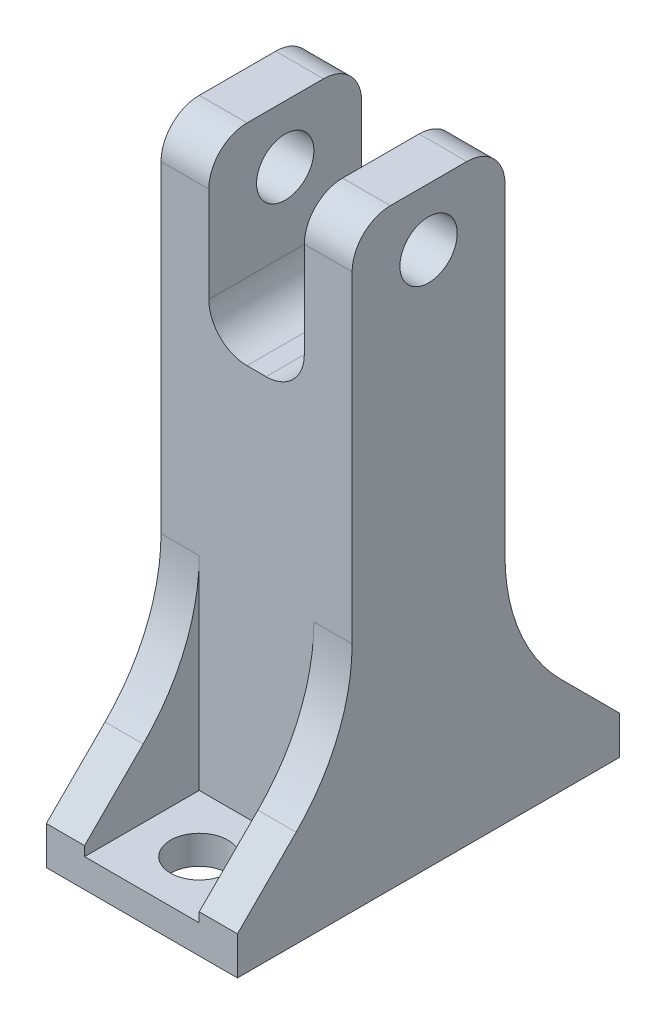
from build123d import *

# Parameters (mm, degrees)
BOSS_EXTRUDE1_DEPTH = 4
SKETCH2_R           = 1.5
CUT_EXTRUDE1_DEPTH  = 19.874586088
BOSS_EXTRUDE2_DEPTH = 5
SKETCH4_W           = 6
SKETCH4_H           = 6
CUT_EXTRUDE2_DEPTH  = 14
SKETCH6_R           = 1.5
CUT_EXTRUDE3_DEPTH  = 20.111514854
FILLET1_R           = 10
FILLET2_R           = 2
FILLET3_R           = 2


with BuildPart() as part:
    # Sketch1 → Boss-Extrude1 (new, symmetric)
    with BuildSketch(Plane.XY):
        Polygon((2.5, 15.5), (5, 15.5), (5, -15.5), (-5, -15.5), (-5, 15.5), (-2.5, 15.5), (-2.5, 6.5), (2.5, 6.5), align=None)
    extrude(amount=BOSS_EXTRUDE1_DEPTH, both=True)

    # Sketch2 → Cut-Extrude1 (cut, through all)
    with BuildSketch(Plane(origin=(5, 0, 0), x_dir=(0, 0, -1), z_dir=(1, 0, 0))):
        with Locations((0, 12.5)):
            Circle(SKETCH2_R)
    extrude(amount=-CUT_EXTRUDE1_DEPTH, mode=Mode.SUBTRACT)

    # Sketch3 → Boss-Extrude2 (add, symmetric)
    with BuildSketch(Plane(origin=(0, 0, 0), x_dir=(0, 0, -1), z_dir=(1, 0, 0))):
        Polygon((-4, -15.5), (-10, -15.5), (-10, -13.5), (-4, -7.5), align=None)
        Polygon((4, -7.5), (4, -15.5), (10, -15.5), (10, -13.5), align=None)
    extrude(amount=BOSS_EXTRUDE2_DEPTH, both=True)

    # Sketch4 → Cut-Extrude2 (cut)
    with BuildSketch(Plane(origin=(0, 0, 0), x_dir=(1, 0, 0), z_dir=(0, 1, 0))):
        with Locations((0, 7)):
            Rectangle(SKETCH4_W, SKETCH4_H)
        with Locations((0, -7)):
            Rectangle(SKETCH4_W, SKETCH4_H)
    extrude(amount=-CUT_EXTRUDE2_DEPTH, mode=Mode.SUBTRACT)

    # Sketch6 → Cut-Extrude3 (cut, through all)
    with BuildSketch(Plane(origin=(0, 0, 0), x_dir=(1, 0, 0), z_dir=(0, 1, 0))):
        with Locations(Location((0, 7, 0), (0, 0, 270))):
            Circle(SKETCH6_R)
        with Locations(Location((0, -7, 0), (0, 0, 270))):
            Circle(SKETCH6_R)
    extrude(amount=-CUT_EXTRUDE3_DEPTH, mode=Mode.SUBTRACT)

    # Fillet1
    fillet1_edges = [part.edges().sort_by_distance(p)[0] for p in [
        (4, -7.5, 4),
        (4, -7.5, -4),
        (-4, -7.5, -4),
        (-4, -7.5, 4),
    ]]
    fillet(fillet1_edges, radius=FILLET1_R)

    # Fillet2
    fillet2_edges = [part.edges().sort_by_distance(p)[0] for p in [
        (-2.5, 6.5, 0),
        (2.5, 6.5, 0),
    ]]
    fillet(fillet2_edges, radius=FILLET2_R)

    # Fillet3
    fillet3_edges = [part.edges().sort_by_distance(p)[0] for p in [
        (3.75, 15.5, -4),
        (-3.75, 15.5, 4),
        (3.75, 15.5, 4),
        (-3.75, 15.5, -4),
    ]]
    fillet(fillet3_edges, radius=FILLET3_R)


solid = part.part
